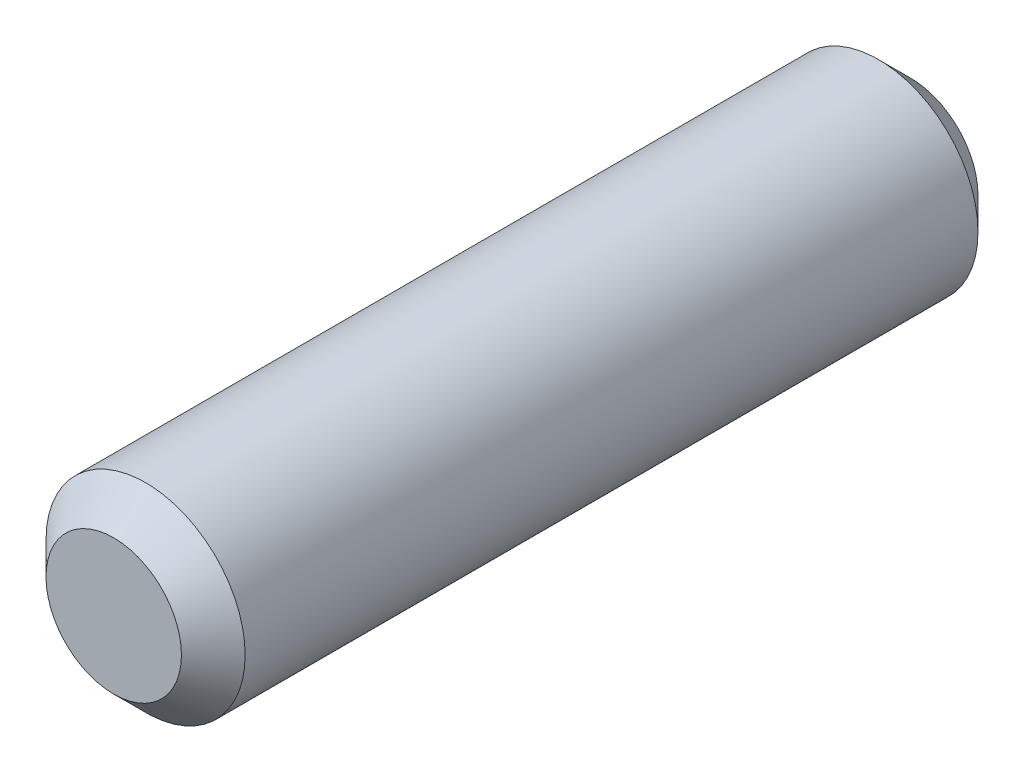
from build123d import *

# Parameters (mm, degrees)
SKETCH1_R           = 1.190625
BOSS_EXTRUDE1_DEPTH = 4.7625
CHAMFER1_SIZE       = 0.381
CHAMFER2_SIZE       = 0.381


with BuildPart() as part:
    # Sketch1 → Boss-Extrude1 (new, symmetric)
    with BuildSketch(Plane.XY):
        with Locations(Location((0, 0, 0), (0, 0, 180))):
            Circle(SKETCH1_R)
    extrude(amount=BOSS_EXTRUDE1_DEPTH, both=True)

    # Chamfer1
    chamfer1_edges = [part.edges().sort_by_distance(p)[0] for p in [
        (1.190625, 0, 4.7625),
    ]]
    chamfer(chamfer1_edges, length=CHAMFER1_SIZE)

    # Chamfer2
    chamfer2_edges = [part.edges().sort_by_distance(p)[0] for p in [
        (1.190625, 0, -4.7625),
    ]]
    chamfer(chamfer2_edges, length=CHAMFER2_SIZE)


solid = part.part
